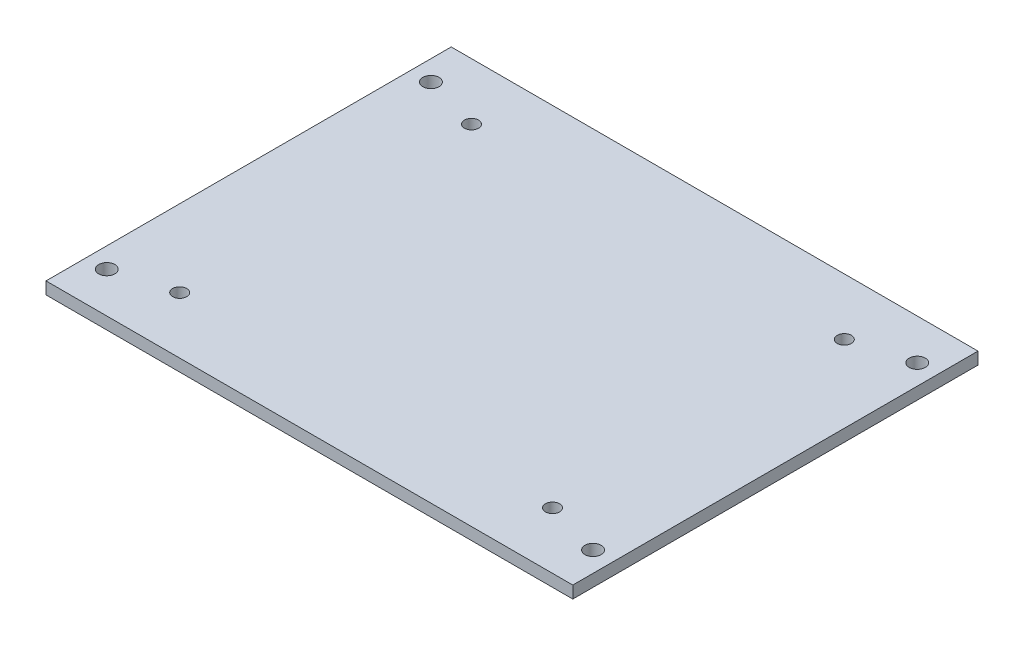
from build123d import *

# Parameters (mm, degrees)
ESBO_O2_W                = 130
ESBO_O2_H                = 100
RESSALTO_EXTRUS_O1_DEPTH = 3
ESBO_O5_R                = 1.75
CORTE_EXTRUS_O1_DEPTH    = 3
ESBO_O6_R                = 2
CORTE_EXTRUS_O2_DEPTH    = 10
ESBO_O7_R                = 2
CORTE_EXTRUS_O3_DEPTH    = 10
ESBO_O8_R                = 2
CORTE_EXTRUS_O4_DEPTH    = 10


with BuildPart() as part:
    # Esboço2 → Ressalto-extrusão1 (new body)
    with BuildSketch(Plane(origin=(0, 0, 0), x_dir=(1, 0, 0), z_dir=(0, 1, 0))):
        with Locations((-65, 50)):
            Rectangle(ESBO_O2_W, ESBO_O2_H)
    extrude(amount=RESSALTO_EXTRUS_O1_DEPTH)

    # Esboço5 → Corte-extrusão1 (cut)
    with BuildSketch(Plane(origin=(0, 3, 0), x_dir=(1, 0, 0), z_dir=(0, 1, 0))):
        with Locations(Location((-111, 86, 0), (0, 0, 270))):
            Circle(ESBO_O5_R)
        with Locations(Location((-19, 86, 0), (0, 0, 270))):
            Circle(ESBO_O5_R)
        with Locations(Location((-19, 14, 0), (0, 0, 270))):
            Circle(ESBO_O5_R)
        with Locations(Location((-111, 14, 0), (0, 0, 270))):
            Circle(ESBO_O5_R)
    extrude(amount=-CORTE_EXTRUS_O1_DEPTH, mode=Mode.SUBTRACT)

    # Esboço6 → Corte-extrusão2 (cut)
    with BuildSketch(Plane(origin=(0, 3, 0), x_dir=(1, 0, 0), z_dir=(0, 1, 0))):
        with Locations(Location((-5, 90, 0), (0, 0, 270))):
            Circle(ESBO_O6_R)
        with Locations(Location((-125, 90, 0), (0, 0, 270))):
            Circle(ESBO_O6_R)
    extrude(amount=-CORTE_EXTRUS_O2_DEPTH, mode=Mode.SUBTRACT)

    # Esboço7 → Corte-extrusão3 (cut)
    with BuildSketch(Plane(origin=(0, 3, 0), x_dir=(1, 0, 0), z_dir=(0, 1, 0))):
        with Locations(Location((-125, 10, 0), (0, 0, 270))):
            Circle(ESBO_O7_R)
    extrude(amount=-CORTE_EXTRUS_O3_DEPTH, mode=Mode.SUBTRACT)

    # Esboço8 → Corte-extrusão4 (cut)
    with BuildSketch(Plane(origin=(0, 3, 0), x_dir=(1, 0, 0), z_dir=(0, 1, 0))):
        with Locations(Location((-5, 10, 0), (0, 0, 270))):
            Circle(ESBO_O8_R)
    extrude(amount=-CORTE_EXTRUS_O4_DEPTH, mode=Mode.SUBTRACT)


solid = part.part
